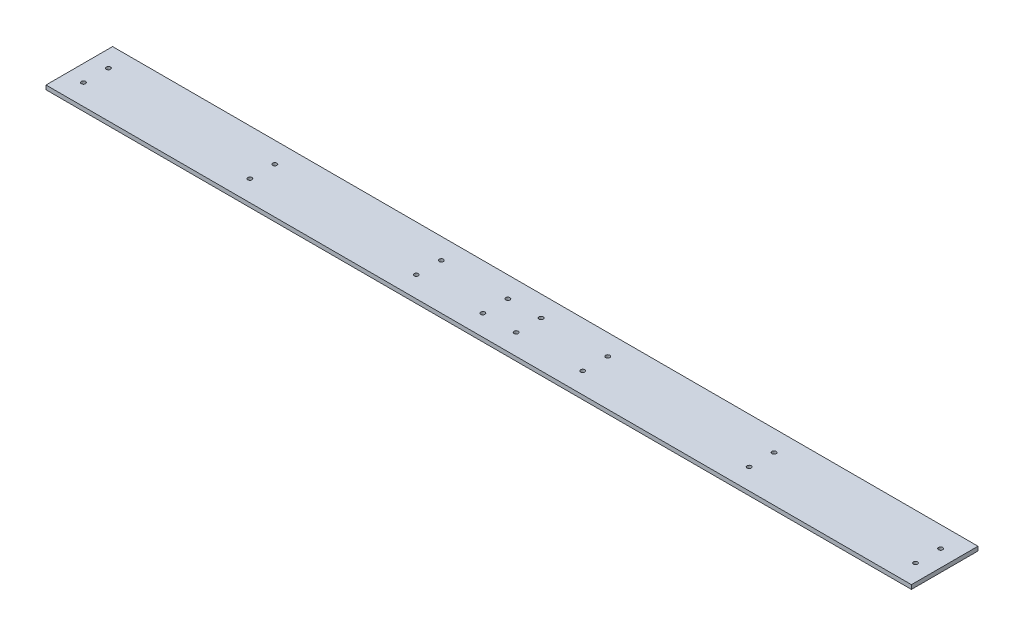
from build123d import *

# Parameters (mm, degrees)
SKETCH1_W           = 1040
SKETCH1_H           = 80
SKETCH1_R           = 2.5
BOSS_EXTRUDE1_DEPTH = 5


with BuildPart() as part:
    # Sketch1 → Boss-Extrude1 (new body)
    with BuildSketch(Plane(origin=(0, 0, 0), x_dir=(1, 0, 0), z_dir=(0, 1, 0))):
        with Locations((500, 0)):
            Rectangle(SKETCH1_W, SKETCH1_H)
        with Locations(Location((0, 15, 0), (0, 0, 270))):
            Circle(SKETCH1_R, mode=Mode.SUBTRACT)
        with Locations(Location((0, -15, 0), (0, 0, 270))):
            Circle(SKETCH1_R, mode=Mode.SUBTRACT)
        with Locations(Location((200, -15, 0), (0, 0, 270))):
            Circle(SKETCH1_R, mode=Mode.SUBTRACT)
        with Locations(Location((200, 15, 0), (0, 0, 270))):
            Circle(SKETCH1_R, mode=Mode.SUBTRACT)
        with Locations(Location((400, -15, 0), (0, 0, 270))):
            Circle(SKETCH1_R, mode=Mode.SUBTRACT)
        with Locations(Location((400, 15, 0), (0, 0, 270))):
            Circle(SKETCH1_R, mode=Mode.SUBTRACT)
        with Locations(Location((600, -15, 0), (0, 0, 270))):
            Circle(SKETCH1_R, mode=Mode.SUBTRACT)
        with Locations(Location((600, 15, 0), (0, 0, 270))):
            Circle(SKETCH1_R, mode=Mode.SUBTRACT)
        with Locations(Location((800, -15, 0), (0, 0, 270))):
            Circle(SKETCH1_R, mode=Mode.SUBTRACT)
        with Locations(Location((800, 15, 0), (0, 0, 270))):
            Circle(SKETCH1_R, mode=Mode.SUBTRACT)
        with Locations(Location((1000, -15, 0), (0, 0, 270))):
            Circle(SKETCH1_R, mode=Mode.SUBTRACT)
        with Locations(Location((1000, 15, 0), (0, 0, 270))):
            Circle(SKETCH1_R, mode=Mode.SUBTRACT)
        with Locations(Location((480, 15, 0), (0, 0, 270))):
            Circle(SKETCH1_R, mode=Mode.SUBTRACT)
        with Locations(Location((520, 15, 0), (0, 0, 270))):
            Circle(SKETCH1_R, mode=Mode.SUBTRACT)
        with Locations(Location((520, -15, 0), (0, 0, 270))):
            Circle(SKETCH1_R, mode=Mode.SUBTRACT)
        with Locations(Location((480, -15, 0), (0, 0, 270))):
            Circle(SKETCH1_R, mode=Mode.SUBTRACT)
    extrude(amount=BOSS_EXTRUDE1_DEPTH)


solid = part.part
